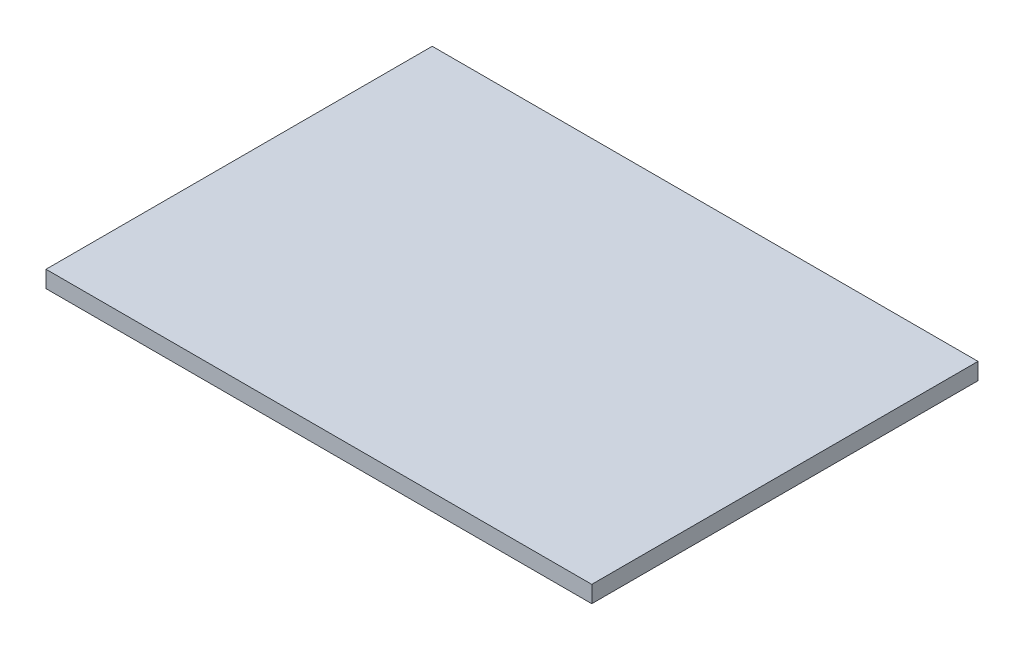
from build123d import *

# Parameters (mm, degrees)
SKETCH1_W           = 46
SKETCH1_H           = 65
BOSS_EXTRUDE1_DEPTH = 2


with BuildPart() as part:
    # Sketch1 → Boss-Extrude1 (new body)
    with BuildSketch(Plane(origin=(0, 0, 0), x_dir=(0, 0, -1), z_dir=(0, 1, 0))):
        Rectangle(SKETCH1_W, SKETCH1_H)
    extrude(amount=BOSS_EXTRUDE1_DEPTH)


solid = part.part
